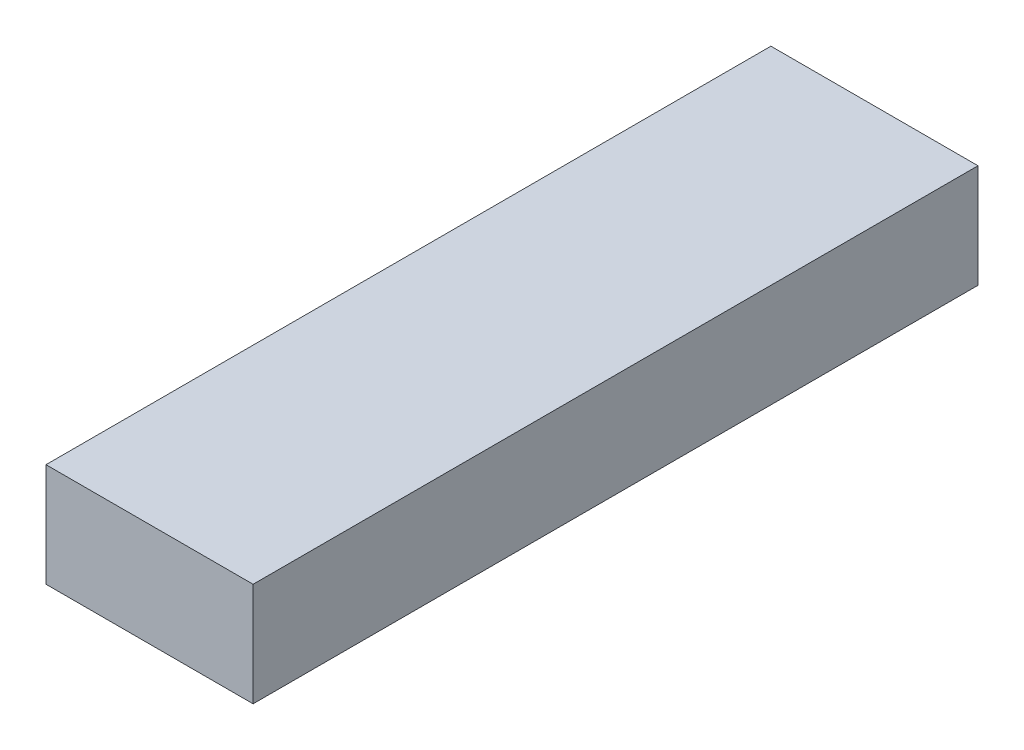
from build123d import *

# Parameters (mm, degrees)
SKETCH1_W           = 20
SKETCH1_H           = 70
BOSS_EXTRUDE1_DEPTH = 10


with BuildPart() as part:
    # Sketch1 → Boss-Extrude1 (new body)
    with BuildSketch(Plane(origin=(0, 0, 0), x_dir=(1, 0, 0), z_dir=(0, 1, 0))):
        Rectangle(SKETCH1_W, SKETCH1_H)
    extrude(amount=BOSS_EXTRUDE1_DEPTH)


solid = part.part
